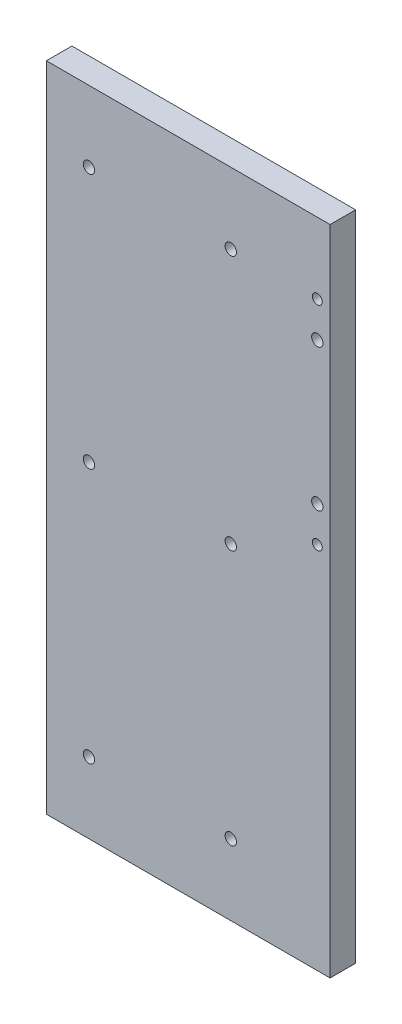
from build123d import *

# Parameters (mm, degrees)
SKETCH1_W                  = 200
SKETCH1_H                  = 460
BOSS_EXTRUDE1_DEPTH        = 18
OTWORY_USTALAJ_CE_8_0MM1_D = 8
OTW_R_7_0_7_1_D            = 7
OTW_R_5_0_5_1_D            = 5
OTW_R_5_0_5_1_DEPTH        = 45
OTW_R_5_0_5_1_TIP          = 1.502151548
OTW_R_8_0_8_1_D            = 8
OTW_R_8_0_8_1_DEPTH        = 15
OTW_R_8_0_8_1_TIP          = 2.403442476
OTW_R_8_0_8_2_D            = 8
OTW_R_8_0_8_2_DEPTH        = 22
OTW_R_8_0_8_2_TIP          = 2.403442476


with BuildPart() as part:
    # Sketch1 → Boss-Extrude1 (new body)
    with BuildSketch(Plane.XY):
        Rectangle(SKETCH1_W, SKETCH1_H)
    extrude(amount=BOSS_EXTRUDE1_DEPTH)

    # Otwory ustalające Ø8.0mm1 (through all)
    with Locations(Plane.XY.offset(18)):
        with Locations((30, -180), (-70, -180), (-70, 0), (30, 0), (30, 180), (-70, 180)):
            Hole(OTWORY_USTALAJ_CE_8_0MM1_D / 2)

    # Otwór Ø7.0 (7)1 (through all)
    with Locations(Plane.XY.offset(18)):
        with Locations((91, 30), (91, 180)):
            Hole(OTW_R_7_0_7_1_D / 2)

    # Otwór Ø5.0 (5)1
    with Locations(Plane(origin=(0, -230, 0), x_dir=(-1, 0, 0), z_dir=(0, -1, 0))):
        with Locations((-50, -9), (50, -9)):
            Hole(OTW_R_5_0_5_1_D / 2, depth=OTW_R_5_0_5_1_DEPTH)
            with Locations((0, 0, -(OTW_R_5_0_5_1_DEPTH + OTW_R_5_0_5_1_TIP / 2))):  # 118° drill point
                Cone(0, OTW_R_5_0_5_1_D / 2, OTW_R_5_0_5_1_TIP, mode=Mode.SUBTRACT)

    # Otwór Ø8.0 (8)1
    with Locations(Plane.XY.offset(18)):
        with Locations((91, 55), (91, 155)):
            Hole(OTW_R_8_0_8_1_D / 2, depth=OTW_R_8_0_8_1_DEPTH)
            with Locations((0, 0, -(OTW_R_8_0_8_1_DEPTH + OTW_R_8_0_8_1_TIP / 2))):  # 118° drill point
                Cone(0, OTW_R_8_0_8_1_D / 2, OTW_R_8_0_8_1_TIP, mode=Mode.SUBTRACT)

    # Otwór Ø8.0 (8)2
    with Locations(Plane(origin=(0, -230, 0), x_dir=(-1, 0, 0), z_dir=(0, -1, 0))):
        with Locations((0, -9)):
            Hole(OTW_R_8_0_8_2_D / 2, depth=OTW_R_8_0_8_2_DEPTH)
            with Locations((0, 0, -(OTW_R_8_0_8_2_DEPTH + OTW_R_8_0_8_2_TIP / 2))):  # 118° drill point
                Cone(0, OTW_R_8_0_8_2_D / 2, OTW_R_8_0_8_2_TIP, mode=Mode.SUBTRACT)


solid = part.part
